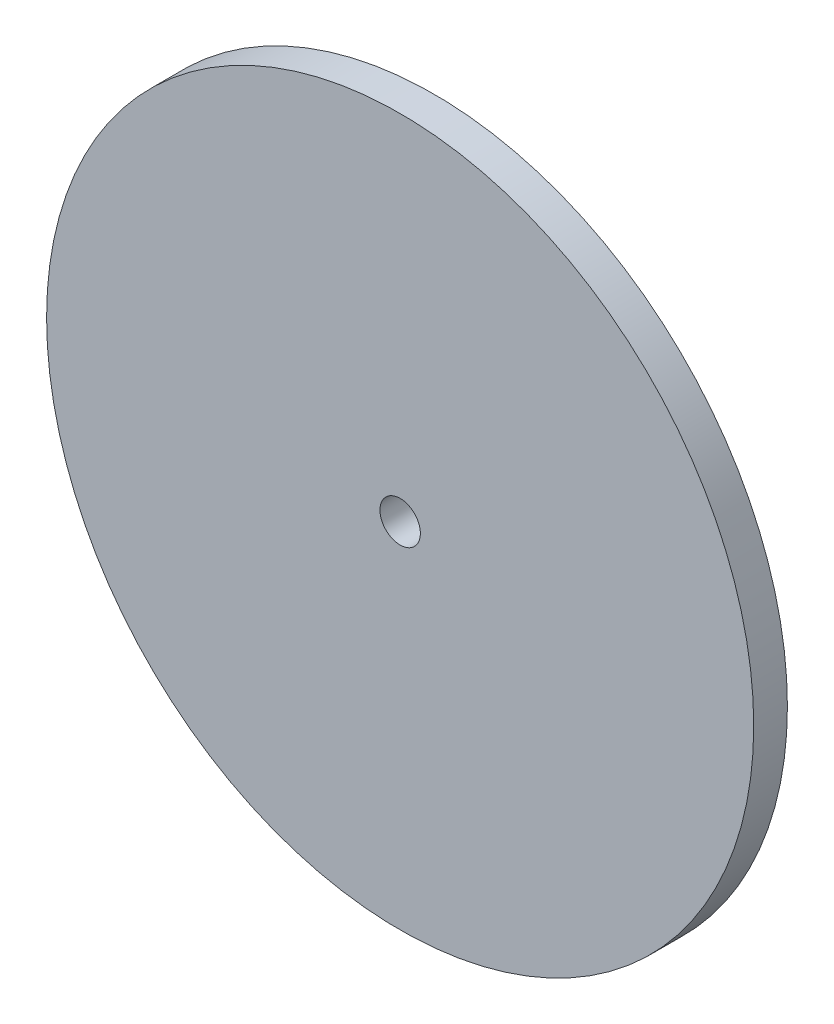
from build123d import *

# Parameters (mm, degrees)
IZIM1_R                     = 8
IZIM1_R_2                   = 3
Y_KSEKLIK_EKSTR_ZYON1_DEPTH = 11.1
Y_KSEKLIK_EKSTR_ZYON2_START = -5
IZIM2_R                     = 52.5
IZIM2_R_2                   = 3
Y_KSEKLIK_EKSTR_ZYON2_DEPTH = 5


with BuildPart() as part:
    # Çizim1 → Yükseklik-Ekstrüzyon1 (new body)
    with BuildSketch(Plane.XY):
        Circle(IZIM1_R)
        Circle(IZIM1_R_2, mode=Mode.SUBTRACT)
    extrude(amount=Y_KSEKLIK_EKSTR_ZYON1_DEPTH)

    # Çizim2 → Yükseklik-Ekstrüzyon2 (add)
    with BuildSketch(Plane.XY.offset(11.1).offset(Y_KSEKLIK_EKSTR_ZYON2_START)):
        Circle(IZIM2_R)
        Circle(IZIM2_R_2, mode=Mode.SUBTRACT)
    extrude(amount=Y_KSEKLIK_EKSTR_ZYON2_DEPTH)


solid = part.part
